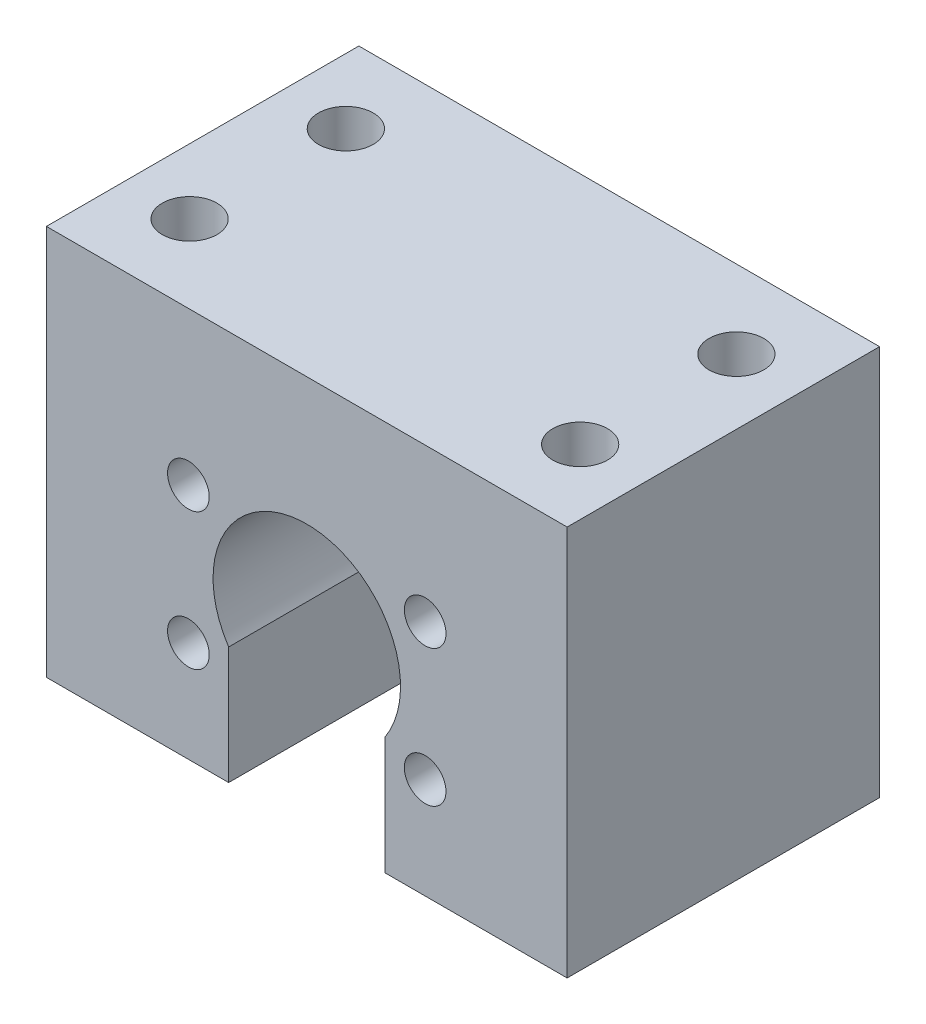
from build123d import *

# Parameters (mm, degrees)
SKETCH_1_W          = 40
SKETCH_1_H          = 30
EXTRUDE_1_DEPTH     = 24
SKETCH_2_R          = 1.6
CUT_EXTRUDE_1_DEPTH = 24
SKETCH_3_R          = 2.1
CUT_EXTRUDE_2_DEPTH = 34


with BuildPart() as part:
    # 草图1 → 凸台-拉伸1 (new body)
    with BuildSketch(Plane.XY):
        with Locations((20, -15)):
            Rectangle(SKETCH_1_W, SKETCH_1_H)
    extrude(amount=EXTRUDE_1_DEPTH)

    # 草图2 → 切除-拉伸1 (cut)
    with BuildSketch(Plane(origin=(0, 0, 0), x_dir=(-1, 0, 0), z_dir=(0, 0, -1))):
        with BuildLine():
            ThreePointArc((-14, -20.979949748), (-20, -9.8), (-26, -20.979949748))
            Line((-26, -20.979949748), (-26, -30))
            Line((-26, -30), (-20, -30))
            Line((-20, -30), (-14, -30))
            Line((-14, -30), (-14, -20.979949748))
        make_face()
        with Locations((-10.90673326, -11.75)):
            Circle(SKETCH_2_R)
        with Locations((-10.90673326, -22.25)):
            Circle(SKETCH_2_R)
        with Locations((-29.09326674, -22.25)):
            Circle(SKETCH_2_R)
        with Locations((-29.09326674, -11.75)):
            Circle(SKETCH_2_R)
    extrude(amount=-CUT_EXTRUDE_1_DEPTH, mode=Mode.SUBTRACT)

    # 草图3 → 切除-拉伸2 (cut)
    with BuildSketch(Plane(origin=(0, 0, 0), x_dir=(1, 0, 0), z_dir=(0, 1, 0))):
        with Locations(Location((5, -6, 0), (0, 0, 270))):
            Circle(SKETCH_3_R)
        with Locations(Location((35, -6, 0), (0, 0, 270))):
            Circle(SKETCH_3_R)
        with Locations(Location((5, -18, 0), (0, 0, 270))):
            Circle(SKETCH_3_R)
        with Locations(Location((35, -18, 0), (0, 0, 270))):
            Circle(SKETCH_3_R)
    extrude(amount=-CUT_EXTRUDE_2_DEPTH, mode=Mode.SUBTRACT)


solid = part.part
